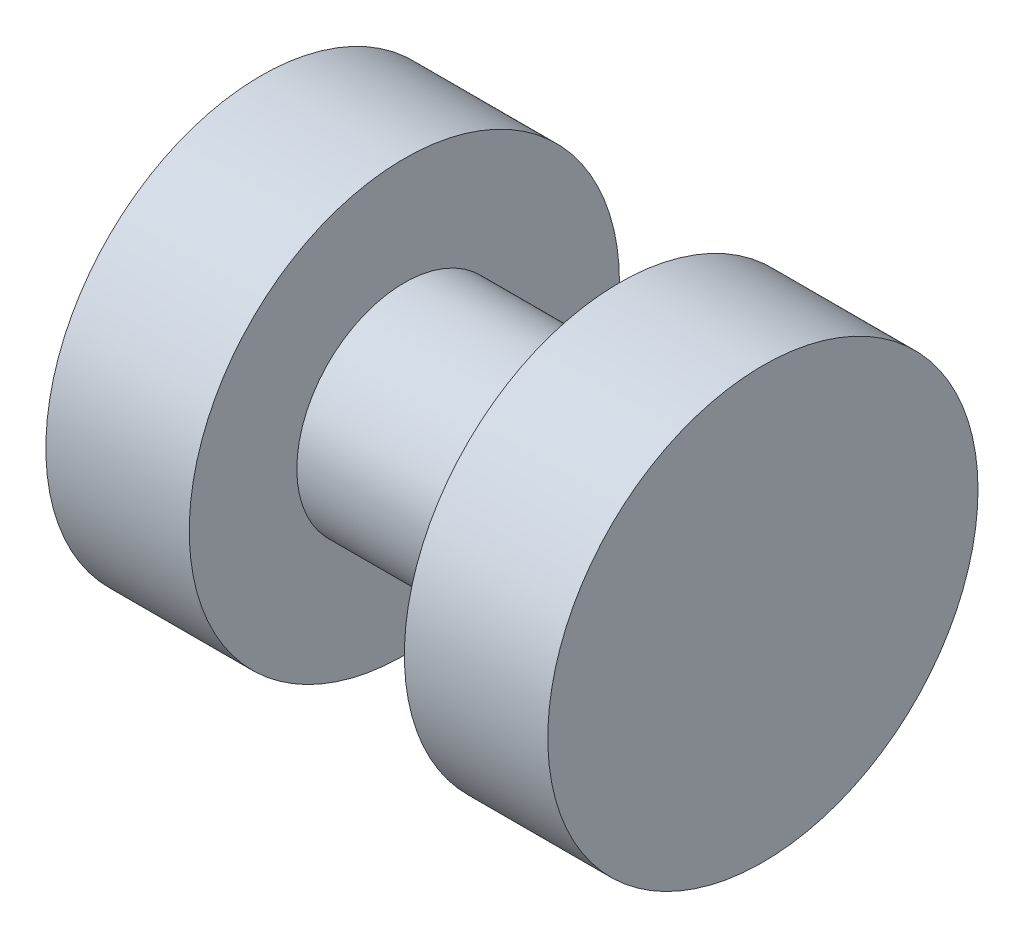
from build123d import *

# Parameters (mm, degrees)
SKETCH1_R           = 3
BOSS_EXTRUDE1_DEPTH = 2
SKETCH2_R           = 1.5
BOSS_EXTRUDE2_DEPTH = 3
SKETCH3_R           = 3
BOSS_EXTRUDE3_DEPTH = 2


with BuildPart() as part:
    # Sketch1 → Boss-Extrude1 (new body)
    with BuildSketch(Plane(origin=(0, 0, 0), x_dir=(0, 0, -1), z_dir=(1, 0, 0))):
        Circle(SKETCH1_R)
    extrude(amount=BOSS_EXTRUDE1_DEPTH)

    # Sketch2 → Boss-Extrude2 (add)
    with BuildSketch(Plane(origin=(2, 0, 0), x_dir=(0, 0, -1), z_dir=(1, 0, 0))):
        Circle(SKETCH2_R)
    extrude(amount=BOSS_EXTRUDE2_DEPTH)

    # Sketch3 → Boss-Extrude3 (add)
    with BuildSketch(Plane(origin=(5, 0, 0), x_dir=(0, 0, -1), z_dir=(1, 0, 0))):
        Circle(SKETCH3_R)
    extrude(amount=BOSS_EXTRUDE3_DEPTH)


solid = part.part
